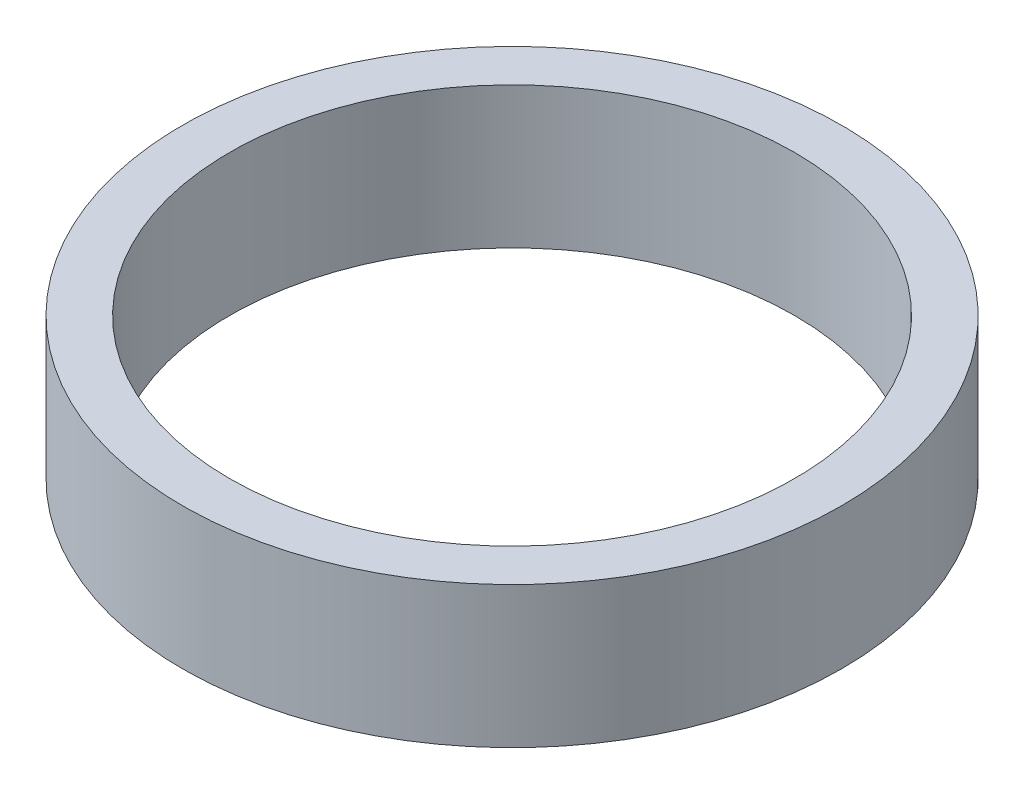
from build123d import *

# Parameters (mm, degrees)
SKETCH1_R           = 7
SKETCH1_R_2         = 6
EXTRUDE_THIN1_DEPTH = 3


with BuildPart() as part:
    # Sketch1 → Extrude-Thin1 (new body)
    with BuildSketch(Plane(origin=(0, 0, 0), x_dir=(1, 0, 0), z_dir=(0, 1, 0))):
        Circle(SKETCH1_R)
        Circle(SKETCH1_R_2, mode=Mode.SUBTRACT)
    extrude(amount=EXTRUDE_THIN1_DEPTH)


solid = part.part
